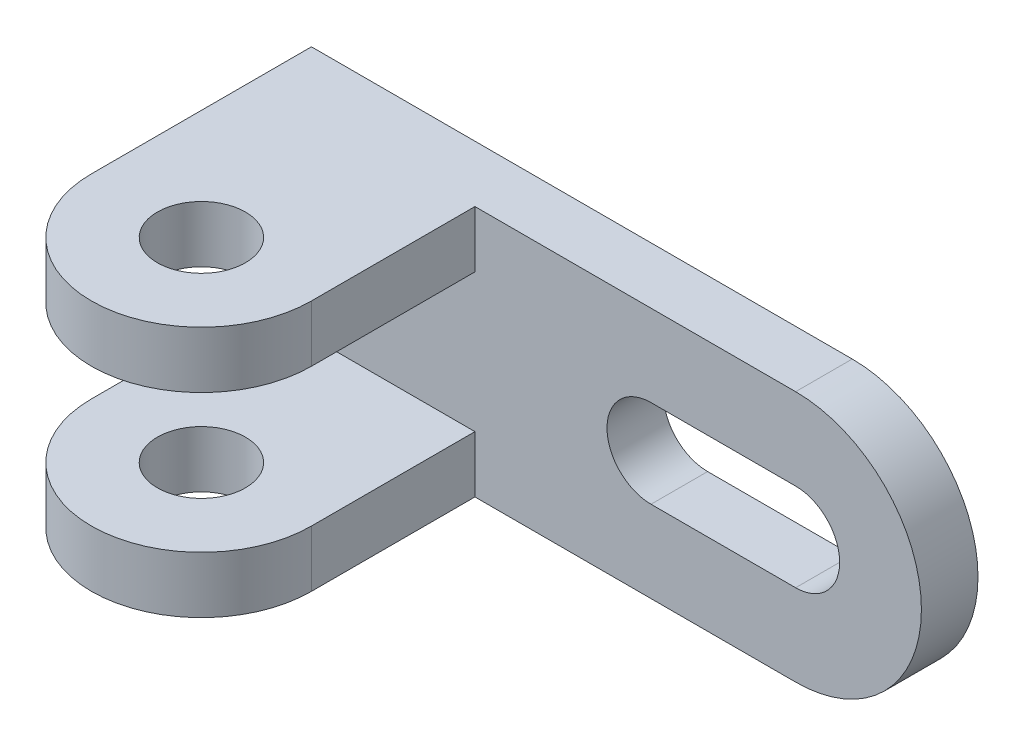
from build123d import *

# Parameters (mm, degrees)
DODANIE_WYCI_GNI_CIE1_DEPTH = 9
SZKIC3_R                    = 17.5
SZKIC3_R_2                  = 7
DODANIE_WYCI_GNI_CIE2_DEPTH = 9
DODANIE_WYCI_GNI_CIE3_START = -9
SZKIC4_R                    = 17.5
SZKIC4_R_2                  = 7
DODANIE_WYCI_GNI_CIE3_DEPTH = 9


with BuildPart() as part:
    # Szkic1 → Dodanie-wyciągnięcie1 (new body)
    with BuildSketch(Plane.XY):
        with BuildLine():
            Line((0, 20), (-86, 20))
            Line((-86, 20), (-86, -20))
            Line((-86, -20), (0, -20))
            ThreePointArc((0, -20), (20, 0), (0, 20))
        make_face()
        with BuildLine():
            ThreePointArc((-23, -7), (-30, 0), (-23, 7))
            Line((-23, 7), (0, 7))
            ThreePointArc((0, 7), (4.949747468, 4.949747468), (7, 0))
            ThreePointArc((7, 0), (4.949747468, -4.949747468), (0, -7))
            Line((0, -7), (-23, -7))
        make_face(mode=Mode.SUBTRACT)
    extrude(amount=DODANIE_WYCI_GNI_CIE1_DEPTH)

    # Szkic3 → Dodanie-wyciągnięcie2 (add)
    # profile 1 of 2: a face of its own
    with BuildSketch(Plane.XZ.offset(20)):
        with Locations((-68.5, 35)):
            Circle(SZKIC3_R)
        with Locations((-68.5, 35)):
            Circle(SZKIC3_R_2, mode=Mode.SUBTRACT)
    # profile 2 of 2: a face of its own
    with BuildSketch(Plane.XZ.offset(20)):
        with BuildLine():
            Line((-86, 35), (-86, 9))
            Line((-86, 9), (-51, 9))
            Line((-51, 9), (-51, 35))
            ThreePointArc((-51, 35), (-68.5, 17.5), (-86, 35))
        make_face()
    extrude(amount=-DODANIE_WYCI_GNI_CIE2_DEPTH)

    # Szkic4 → Dodanie-wyciągnięcie3 (add)
    # profile 1 of 2: a face of its own
    with BuildSketch(Plane(origin=(0, 20, 0), x_dir=(1, 0, 0), z_dir=(0, 1, 0)).offset(DODANIE_WYCI_GNI_CIE3_START)):
        with BuildLine():
            Line((-51, -9), (-86, -9))
            Line((-86, -9), (-86, -35))
            ThreePointArc((-86, -35), (-68.5, -17.5), (-51, -35))
            Line((-51, -35), (-51, -9))
        make_face()
    # profile 2 of 2: a face of its own
    with BuildSketch(Plane(origin=(0, 20, 0), x_dir=(1, 0, 0), z_dir=(0, 1, 0)).offset(DODANIE_WYCI_GNI_CIE3_START)):
        with Locations((-68.5, -35)):
            Circle(SZKIC4_R)
        with Locations((-68.5, -35)):
            Circle(SZKIC4_R_2, mode=Mode.SUBTRACT)
    extrude(amount=DODANIE_WYCI_GNI_CIE3_DEPTH)


solid = part.part
